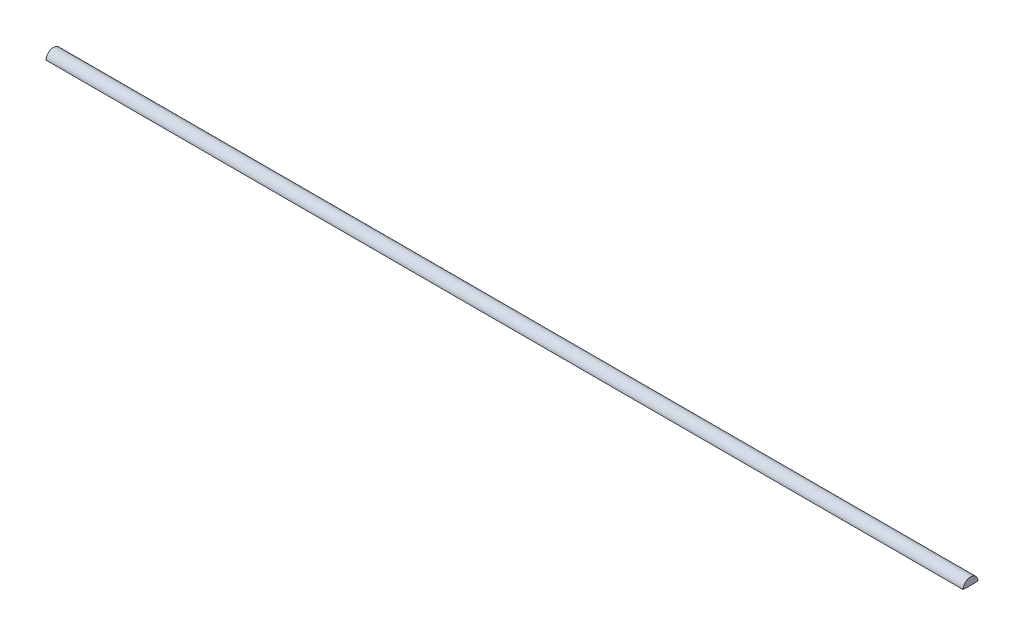
from build123d import *

# Parameters (mm, degrees)
BOSS_EXTRUDE1_DEPTH = 389.89


with BuildPart() as part:
    # Sketch1 → Boss-Extrude1 (new body)
    with BuildSketch(Plane(origin=(0, 0, 0), x_dir=(0, 0, -1), z_dir=(1, 0, 0))):
        with BuildLine():
            ThreePointArc((-3.174007657, -63.420625), (0, -63.5), (3.174007657, -63.420625))
            ThreePointArc((3.174007657, -63.420625), (0, -60.325), (-3.174007657, -63.420625))
        make_face()
    extrude(amount=BOSS_EXTRUDE1_DEPTH)


solid = part.part
